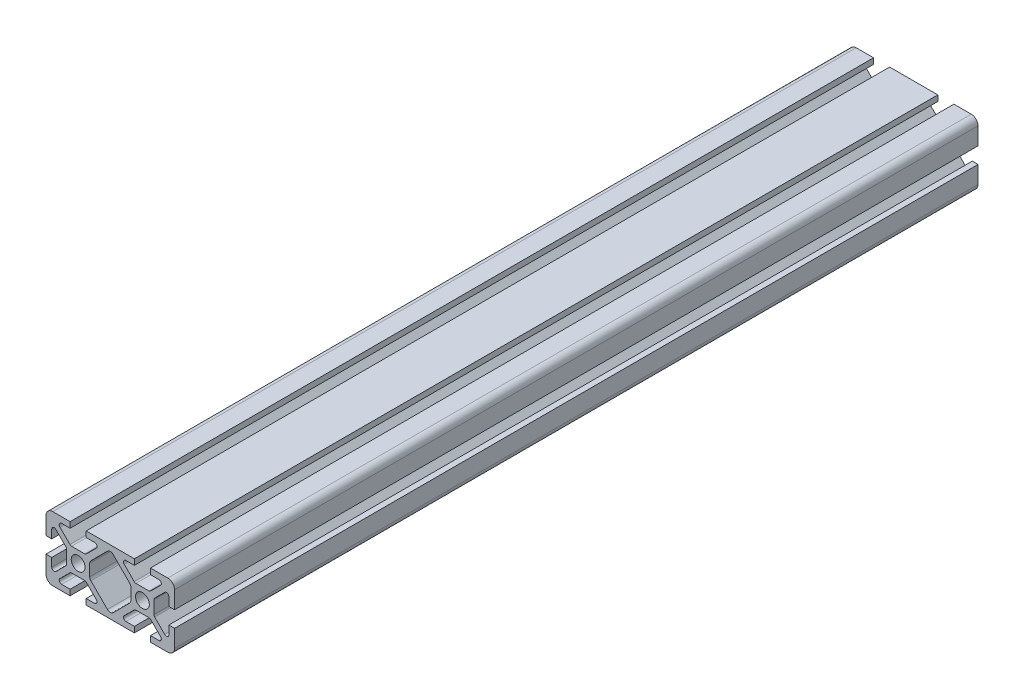
from build123d import *

# Parameters (mm, degrees)
BOSS_EXTRUDE1_DEPTH = 125
BOSS_EXTRUDE2_DEPTH = 125
FILLET1_R           = 0.75
FILLET2_R           = 1.25


with BuildPart() as part:
    # Sketch3 → Boss-Extrude1 (new, symmetric)
    with BuildSketch(Plane.XY):
        with BuildLine():
            Line((12.5, -10), (17.9, -10))
            ThreePointArc((17.9, -10), (19.38492424, -9.38492424), (20, -7.9))
            Line((20, -7.9), (20, -2.5))
            Line((20, -2.5), (18.213351365, -2.5))
            Line((18.213351365, -2.5), (18.213351365, -6.95))
            Line((18.213351365, -6.95), (13.6, -2.336648635))
            Line((13.6, -2.336648635), (13.6, 0))
            Line((13.6, 0), (12.15, 0))
            ThreePointArc((12.15, 0), (11.52027958, -1.52027958), (10, -2.15))
            Line((10, -2.15), (10, -3.6))
            Line((10, -3.6), (12.336648635, -3.6))
            Line((12.336648635, -3.6), (16.95, -8.213351365))
            Line((16.95, -8.213351365), (12.5, -8.213351365))
            Line((12.5, -8.213351365), (12.5, -10))
        make_face()
    extrude(amount=BOSS_EXTRUDE1_DEPTH, both=True)

    # Sketch4 → Boss-Extrude2 (add, symmetric)
    with BuildSketch(Plane.XY):
        with BuildLine():
            Line((10, -3.6), (7.663351365, -3.6))
            Line((7.663351365, -3.6), (3.05, -8.213351365))
            Line((3.05, -8.213351365), (7.5, -8.213351365))
            Line((7.5, -8.213351365), (7.5, -10))
            Line((7.5, -10), (0, -10))
            Line((0, -10), (0, -8.736648635))
            Line((0, -8.736648635), (6.4, -2.336648635))
            Line((6.4, -2.336648635), (6.4, 0))
            Line((6.4, 0), (7.85, 0))
            ThreePointArc((7.85, 0), (8.47972042, -1.52027958), (10, -2.15))
            Line((10, -2.15), (10, -3.6))
        make_face()
    extrude(amount=BOSS_EXTRUDE2_DEPTH, both=True)

    # Mirror1: part across plane


with BuildPart() as part_1:
    add(part.part)
    add(part.part.mirror(Plane(origin=(0, 0, 0), x_dir=(0, 0, 1), z_dir=(1, 0, 0))))

    # Mirror2: part across plane


with BuildPart() as part_2:
    add(part_1.part)
    add(part_1.part.mirror(Plane.ZX))

    # Fillet1
    fillet1_edges = [part_2.edges().sort_by_distance(p)[0] for p in [
        (18.213351365, 6.95, 0),
        (13.6, 2.336648635, 0),
        (12.336648635, 3.6, 0),
        (16.95, 8.213351365, 0),
        (3.05, 8.213351365, 0),
        (7.663351365, 3.6, 0),
        (-18.213351365, 6.95, 0),
        (-13.6, 2.336648635, 0),
        (-7.663351365, 3.6, 0),
        (-12.336648635, 3.6, 0),
        (-16.95, 8.213351365, 0),
        (-3.05, 8.213351365, 0),
        (16.95, -8.213351365, 0),
        (12.336648635, -3.6, 0),
        (13.6, -2.336648635, 0),
        (18.213351365, -6.95, 0),
        (3.05, -8.213351365, 0),
        (7.663351365, -3.6, 0),
        (-18.213351365, -6.95, 0),
        (-13.6, -2.336648635, 0),
        (-12.336648635, -3.6, 0),
        (-16.95, -8.213351365, 0),
        (-3.05, -8.213351365, 0),
        (-7.663351365, -3.6, 0),
    ]]
    fillet(fillet1_edges, radius=FILLET1_R)

    # Fillet2
    fillet2_edges = [part_2.edges().sort_by_distance(p)[0] for p in [
        (6.4, 2.336648635, 0),
        (0, 8.736648635, 0),
        (-6.4, 2.336648635, 0),
        (6.4, -2.336648635, 0),
        (-6.4, -2.336648635, 0),
        (0, -8.736648635, 0),
    ]]
    fillet(fillet2_edges, radius=FILLET2_R)


solid = part_2.part
